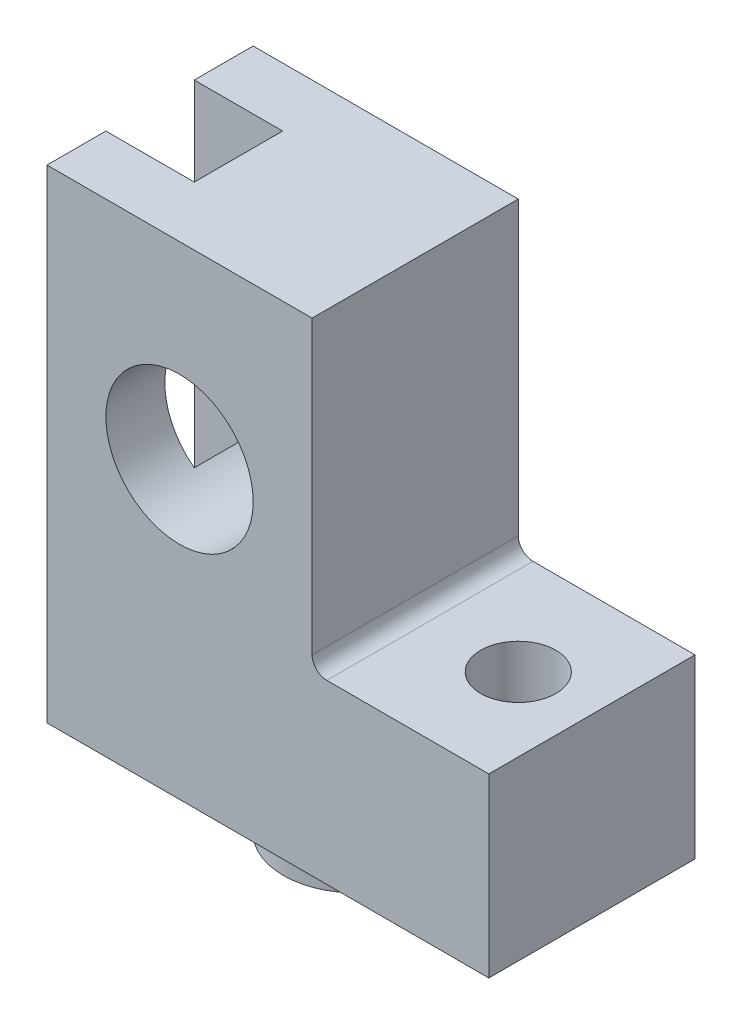
from build123d import *

# Parameters (mm, degrees)
SKETCH_1_R          = 5
EXTRUDE_1_DEPTH     = 7
SKETCH_2_R          = 2.55
CUT_EXTRUDE_1_DEPTH = 31.374989712
CUT_EXTRUDE_2_DEPTH = 40.570696228
FILLET_2_R          = 1
SKETCH_5_R          = 4.95
EXTRUDE_2_DEPTH     = 3


with BuildPart() as part:
    # 草图1 → 凸台-拉伸1 (new, symmetric)
    with BuildSketch(Plane.XY):
        Polygon((-21, 0), (21, 0), (21, 12), (9, 12), (9, 32.8), (-9, 32.8), (-9, 12), (-21, 12), align=None)
        with Locations((0, 20)):
            Circle(SKETCH_1_R, mode=Mode.SUBTRACT)
    extrude(amount=EXTRUDE_1_DEPTH, both=True)

    # 草图2 → 切除-拉伸1 (cut, through all)
    with BuildSketch(Plane(origin=(0, 12, 0), x_dir=(1, 0, 0), z_dir=(0, 1, 0))):
        with Locations(Location((16, 0, 0), (0, 0, 270))):
            Circle(SKETCH_2_R)
        with Locations(Location((-16, 0, 0), (0, 0, 90))):
            Circle(SKETCH_2_R)
    extrude(amount=-CUT_EXTRUDE_1_DEPTH, mode=Mode.SUBTRACT)

    # 草图4 → 切除-拉伸2 (cut, through all)
    with BuildSketch(Plane(origin=(0, 32.8, 0), x_dir=(1, 0, 0), z_dir=(0, 1, 0))):
        Polygon((-9, 3), (-3, 3), (-3, -3), (-9, -3), (-9, -7), (-21, -7), (-21, 7), (-9, 7), align=None)
    extrude(amount=-CUT_EXTRUDE_2_DEPTH, mode=Mode.SUBTRACT)

    # 圆角2
    fillet_2_edges = [part.edges().sort_by_distance(p)[0] for p in [
        (9, 12, 0),
    ]]
    fillet(fillet_2_edges, radius=FILLET_2_R)

    # 草图5 → 凸台-拉伸2 (add)
    with BuildSketch(Plane.XZ):
        with Locations(Location((5, 0, 0), (0, 0, 180))):
            Circle(SKETCH_5_R)
    extrude(amount=EXTRUDE_2_DEPTH)


solid = part.part
